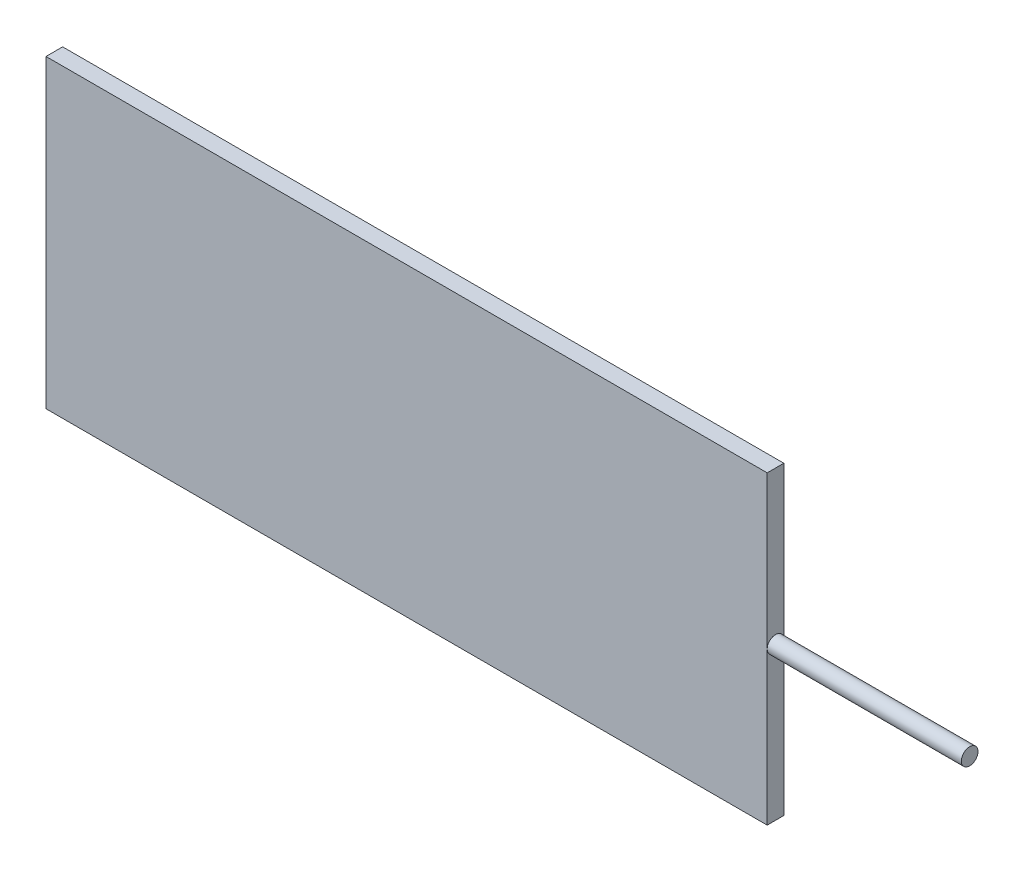
from build123d import *

# Parameters (mm, degrees)
SKETCH_1_W      = 260
SKETCH_1_H      = 110
EXTRUDE_1_DEPTH = 6
SKETCH_2_R      = 3
EXTRUDE_2_DEPTH = 70


with BuildPart() as part:
    # 草图1 → 凸台-拉伸1 (new body)
    with BuildSketch(Plane.XY):
        with Locations((130, 55)):
            Rectangle(SKETCH_1_W, SKETCH_1_H)
    extrude(amount=EXTRUDE_1_DEPTH)

    # 草图2 → 凸台-拉伸2 (add)
    with BuildSketch(Plane(origin=(260, 0, 0), x_dir=(0, 0, -1), z_dir=(1, 0, 0))):
        with Locations((-3, 55)):
            Circle(SKETCH_2_R)
    extrude(amount=EXTRUDE_2_DEPTH)


solid = part.part
